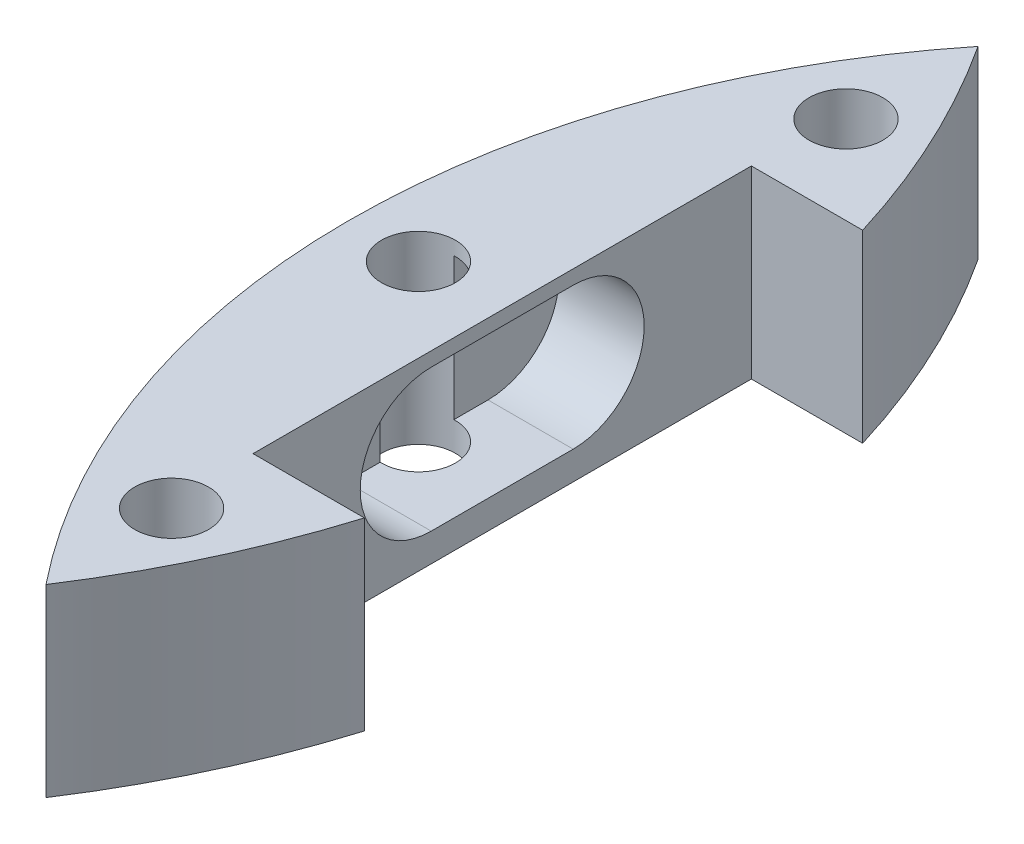
from build123d import *

# Parameters (mm, degrees)
SKETCH_1_R          = 2.6
EXTRUDE_1_DEPTH     = 13
SKETCH_2_W          = 0.6
SKETCH_2_H          = 35.1
CUT_EXTRUDE_1_DEPTH = 23
CUT_EXTRUDE_2_DEPTH = 6


with BuildPart() as part:
    # 草图1 → 凸台-拉伸1 (new body)
    with BuildSketch(Plane(origin=(0, 0, 0), x_dir=(1, 0, 0), z_dir=(0, 1, 0))):
        with BuildLine():
            Line((-33.760275315, -17.55), (-41, -17.55))
            Line((-41, -17.55), (-41, 17.55))
            Line((-41, 17.55), (-33.760275315, 17.55))
            ThreePointArc((-33.760275315, 17.55), (-36.796000438, 25.438985546), (-40.910253672, 32.823065739))
            ThreePointArc((-40.910253672, 32.823065739), (-52.45, 0), (-40.910253672, -32.823065739))
            ThreePointArc((-40.910253672, -32.823065739), (-36.796000438, -25.438985546), (-33.760275315, -17.55))
        make_face()
        with Locations(Location((-41.13620668, -23.75, 0), (0, 0, 90))):
            Circle(SKETCH_1_R, mode=Mode.SUBTRACT)
        with Locations(Location((-41.13620668, 23.75, 0), (0, 0, 90))):
            Circle(SKETCH_1_R, mode=Mode.SUBTRACT)
        with Locations(Location((-47.5, 0, 0), (0, 0, 90))):
            Circle(SKETCH_1_R, mode=Mode.SUBTRACT)
    extrude(amount=EXTRUDE_1_DEPTH)

    # 草图2 → 切除-拉伸1 (cut)
    with BuildSketch(Plane(origin=(0, 13, 0), x_dir=(1, 0, 0), z_dir=(0, 1, 0))):
        with Locations((-41.3, 0)):
            Rectangle(SKETCH_2_W, SKETCH_2_H)
    extrude(amount=-CUT_EXTRUDE_1_DEPTH, mode=Mode.SUBTRACT)

    # 草图3 → 切除-拉伸2 (cut)
    with BuildSketch(Plane(origin=(-41.6, 0, 0), x_dir=(0, 0, -1), z_dir=(1, 0, 0))):
        with BuildLine():
            Line((-5, 12), (5, 12))
            ThreePointArc((5, 12), (10, 7), (5, 2))
            Line((5, 2), (-5, 2))
            ThreePointArc((-5, 2), (-10, 7), (-5, 12))
        make_face()
    extrude(amount=-CUT_EXTRUDE_2_DEPTH, mode=Mode.SUBTRACT)


solid = part.part
